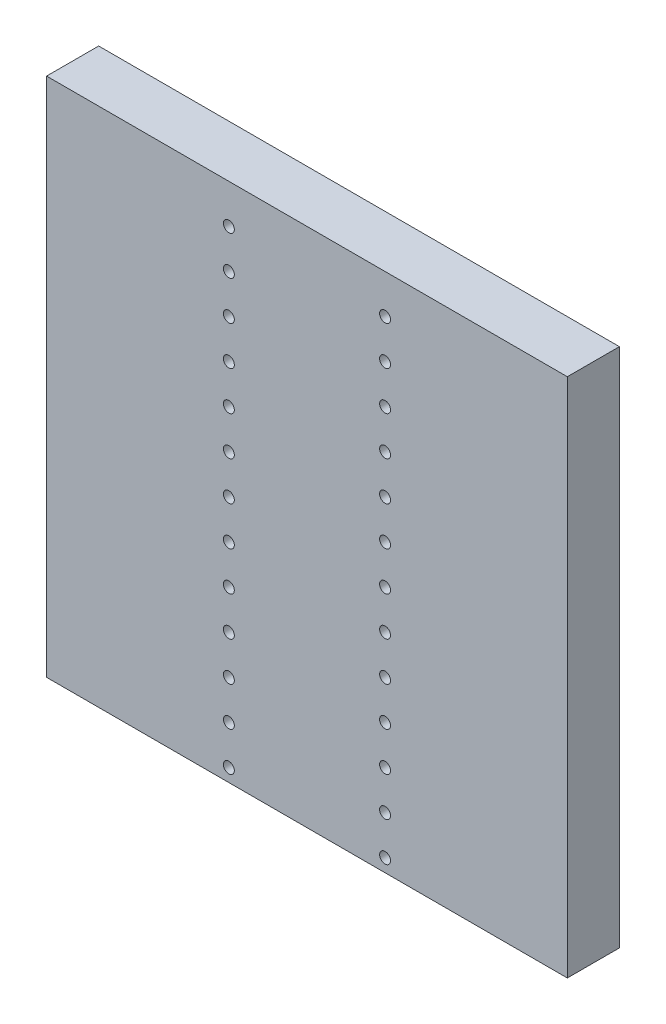
from build123d import *

# Parameters (mm, degrees)
SKETCH1_W             = 200
SKETCH1_H             = 200
BOSS_EXTRUDE1_DEPTH   = 20
M5X0_8_TAPPED_HOLE1_D = 4.2
LPATTERN1_COUNT       = 13
LPATTERN1_PITCH       = 15
MIRROR1_COPY_1_D      = 4.2
MIRROR1_COPY_2_D      = 4.2
MIRROR1_COPY_3_D      = 4.2
MIRROR1_COPY_4_D      = 4.2
MIRROR1_COPY_5_D      = 4.2
MIRROR1_COPY_6_D      = 4.2
MIRROR1_COPY_7_D      = 4.2
MIRROR1_COPY_8_D      = 4.2
MIRROR1_COPY_9_D      = 4.2
MIRROR1_COPY_10_D     = 4.2
MIRROR1_COPY_11_D     = 4.2
MIRROR1_COPY_12_D     = 4.2


with BuildPart() as part:
    # Sketch1 → Boss-Extrude1 (new body)
    with BuildSketch(Plane.XY):
        Rectangle(SKETCH1_W, SKETCH1_H)
    extrude(amount=BOSS_EXTRUDE1_DEPTH)

    # M5x0.8 Tapped Hole1 (through all)
    with Locations(Plane(origin=(30, -95, 20), x_dir=(1, 0, 0), z_dir=(0, 0, 1))):
        with Locations((0, 0)):
            m5x0_8_tapped_hole1 = Hole(M5X0_8_TAPPED_HOLE1_D / 2)

    # LPattern1: M5x0.8 Tapped Hole1 ×13
    with Locations(*[(0, i * LPATTERN1_PITCH, 0) for i in range(1, LPATTERN1_COUNT)]):
        add(m5x0_8_tapped_hole1, mode=Mode.SUBTRACT)

    # Mirror1: M5x0.8 Tapped Hole1 across plane
    add(m5x0_8_tapped_hole1.mirror(Plane(origin=(0, 0, 0), x_dir=(0, 0, 1), z_dir=(1, 0, 0))), mode=Mode.SUBTRACT)

    # Mirror1 copy 1 (through all)
    with Locations(Plane(origin=(-30, -80, 20), x_dir=(-1, 0, 0), z_dir=(0, 0, 1))):
        with Locations((0, 0)):
            Hole(MIRROR1_COPY_1_D / 2)

    # Mirror1 copy 2 (through all)
    with Locations(Plane(origin=(-30, -65, 20), x_dir=(-1, 0, 0), z_dir=(0, 0, 1))):
        with Locations((0, 0)):
            Hole(MIRROR1_COPY_2_D / 2)

    # Mirror1 copy 3 (through all)
    with Locations(Plane(origin=(-30, -50, 20), x_dir=(-1, 0, 0), z_dir=(0, 0, 1))):
        with Locations((0, 0)):
            Hole(MIRROR1_COPY_3_D / 2)

    # Mirror1 copy 4 (through all)
    with Locations(Plane(origin=(-30, -35, 20), x_dir=(-1, 0, 0), z_dir=(0, 0, 1))):
        with Locations((0, 0)):
            Hole(MIRROR1_COPY_4_D / 2)

    # Mirror1 copy 5 (through all)
    with Locations(Plane(origin=(-30, -20, 20), x_dir=(-1, 0, 0), z_dir=(0, 0, 1))):
        with Locations((0, 0)):
            Hole(MIRROR1_COPY_5_D / 2)

    # Mirror1 copy 6 (through all)
    with Locations(Plane(origin=(-30, -5, 20), x_dir=(-1, 0, 0), z_dir=(0, 0, 1))):
        with Locations((0, 0)):
            Hole(MIRROR1_COPY_6_D / 2)

    # Mirror1 copy 7 (through all)
    with Locations(Plane(origin=(-30, 10, 20), x_dir=(-1, 0, 0), z_dir=(0, 0, 1))):
        with Locations((0, 0)):
            Hole(MIRROR1_COPY_7_D / 2)

    # Mirror1 copy 8 (through all)
    with Locations(Plane(origin=(-30, 25, 20), x_dir=(-1, 0, 0), z_dir=(0, 0, 1))):
        with Locations((0, 0)):
            Hole(MIRROR1_COPY_8_D / 2)

    # Mirror1 copy 9 (through all)
    with Locations(Plane(origin=(-30, 40, 20), x_dir=(-1, 0, 0), z_dir=(0, 0, 1))):
        with Locations((0, 0)):
            Hole(MIRROR1_COPY_9_D / 2)

    # Mirror1 copy 10 (through all)
    with Locations(Plane(origin=(-30, 55, 20), x_dir=(-1, 0, 0), z_dir=(0, 0, 1))):
        with Locations((0, 0)):
            Hole(MIRROR1_COPY_10_D / 2)

    # Mirror1 copy 11 (through all)
    with Locations(Plane(origin=(-30, 70, 20), x_dir=(-1, 0, 0), z_dir=(0, 0, 1))):
        with Locations((0, 0)):
            Hole(MIRROR1_COPY_11_D / 2)

    # Mirror1 copy 12 (through all)
    with Locations(Plane(origin=(-30, 85, 20), x_dir=(-1, 0, 0), z_dir=(0, 0, 1))):
        with Locations((0, 0)):
            Hole(MIRROR1_COPY_12_D / 2)


solid = part.part
